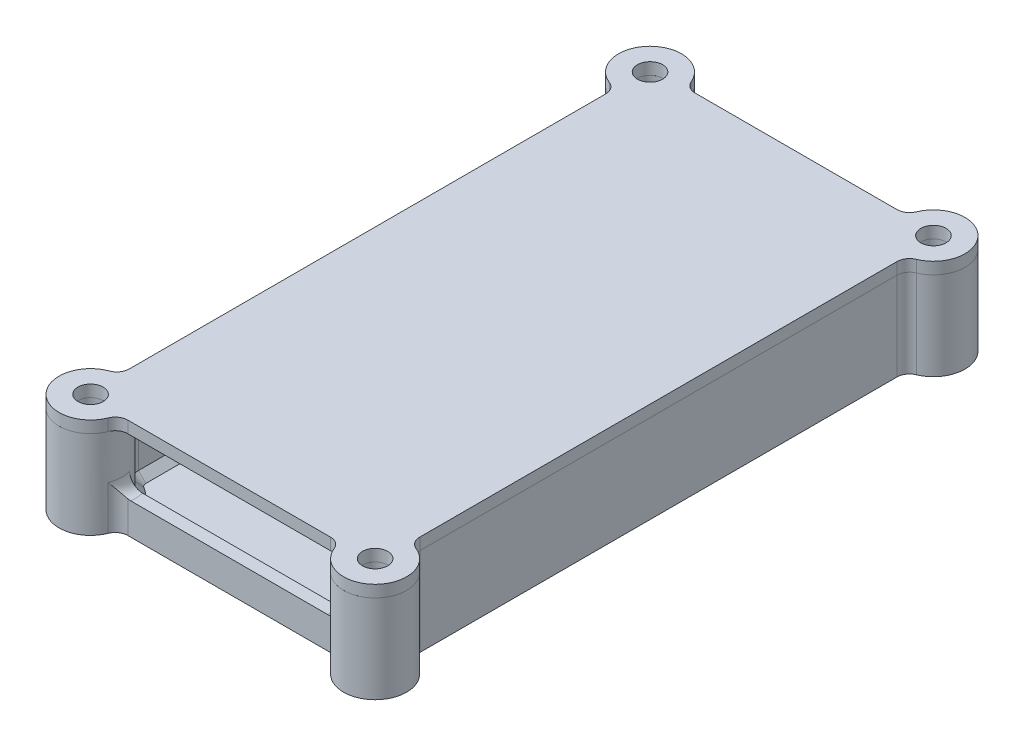
from build123d import *

# Parameters (mm, degrees)
SKETCH1_R             = 2.54
BOSS_EXTRUDE1_DEPTH   = 17.78
SKETCH1_W             = 2.54
SKETCH1_H             = 50.8
BOSS_EXTRUDE1_2_DEPTH = 17.78
SKETCH25_W            = 25.4
SKETCH25_H            = 50.8
SKETCH25_R            = 1.4605
BOSS_EXTRUDE10_DEPTH  = 2.54
SKETCH16_R            = 1.4605
BOSS_EXTRUDE8_DEPTH   = 7.62
SKETCH17_W            = 53.34
SKETCH17_H            = 2.54
BOSS_EXTRUDE9_DEPTH   = 10.16
BOSS_EXTRUDE11_DEPTH  = 6.35
CUT_EXTRUDE7_REACH    = 128.18
SKETCH20_W            = 25.4
SKETCH20_H            = 11.43
FILLET1_R             = 2.54
CHAMFER1_SIZE         = 1.5
CHAMFER2_SIZE         = 0.399999962
SKETCH28_R            = 2.54
BOSS_EXTRUDE12_DEPTH  = 2.38125


with BuildPart() as part:
    # Sketch1 → Boss-Extrude1 (new body)
    with BuildSketch(Plane(origin=(0, 0, 0), x_dir=(1, 0, 0), z_dir=(0, 1, 0))):
        with BuildLine():
            Line((-26.67, -38.956245374), (-26.67, 61.662538154))
            ThreePointArc((-26.67, 61.662538154), (-24.002733366, 63.313593433), (-22.451281767, 66.04))
            Line((-22.451281767, 66.04), (22.451281767, 66.04))
            ThreePointArc((22.451281767, 66.04), (24.002733366, 63.313593433), (26.67, 61.662538154))
            Line((26.67, 61.662538154), (26.67, -38.956245374))
            ThreePointArc((26.67, -38.956245374), (29.345391856, -51.292242337), (29.434947917, -38.669781311))
            Line((29.434947917, -38.669781311), (29.434947917, 61.428550705))
            ThreePointArc((29.434947917, 61.428550705), (33.065128061, 72.210180143), (22.283498623, 68.58))
            Line((22.283498623, 68.58), (-22.283498623, 68.58))
            ThreePointArc((-22.283498623, 68.58), (-33.14450183, 72.129377771), (-29.21, 61.401881857))
            Line((-29.21, 61.401881857), (-29.21, -38.647296362))
            ThreePointArc((-29.21, -38.647296362), (-29.457720789, -51.27959292), (-26.67, -38.956245374))
        make_face()
        with Locations(Location((-28.690999142, -44.976051224, 0), (0, 0, 270))):
            Circle(SKETCH1_R, mode=Mode.SUBTRACT)
        with Locations(Location((-28.575, 67.720052083, 0), (0, 0, 270))):
            Circle(SKETCH1_R, mode=Mode.SUBTRACT)
        with Locations(Location((28.690999142, -44.976051224, 0), (0, 0, 270))):
            Circle(SKETCH1_R, mode=Mode.SUBTRACT)
        with Locations(Location((28.575, 67.720052083, 0), (0, 0, 270))):
            Circle(SKETCH1_R, mode=Mode.SUBTRACT)
    extrude(amount=BOSS_EXTRUDE1_DEPTH)



with BuildPart() as body_2:
    # Sketch1 → Boss-Extrude1 2 (new body)
    with BuildSketch(Plane(origin=(0, 0, 0), x_dir=(1, 0, 0), z_dir=(0, 1, 0))):
        Rectangle(SKETCH1_W, SKETCH1_H)
    extrude(amount=BOSS_EXTRUDE1_2_DEPTH)


with BuildPart() as part_1:
    add(part.part)

    add(body_2.part)  # Boss-Extrude10 merges body 2
    # Sketch25 → Boss-Extrude10 (add)
    # profile 1 of 4: a face of its own
    with BuildSketch(Plane(origin=(0, 0, 0), x_dir=(1, 0, 0), z_dir=(0, 1, 0))):
        with Locations((-13.97, 0)):
            Rectangle(SKETCH25_W, SKETCH25_H)
        with Locations(Location((-4.6736, 16.637, 0), (0, 0, 270))):
            Circle(SKETCH25_R, mode=Mode.SUBTRACT)
        with Locations(Location((-23.368, -17.78, 0), (0, 0, 270))):
            Circle(SKETCH25_R, mode=Mode.SUBTRACT)
    # profile 2 of 4: a face of its own
    with BuildSketch(Plane(origin=(0, 0, 0), x_dir=(1, 0, 0), z_dir=(0, 1, 0))):
        with Locations((13.97, 0)):
            Rectangle(SKETCH25_W, SKETCH25_H)
        with Locations(Location((4.572, -17.78, 0), (0, 0, 270))):
            Circle(SKETCH25_R, mode=Mode.SUBTRACT)
        with Locations(Location((23.2664, 16.637, 0), (0, 0, 270))):
            Circle(SKETCH25_R, mode=Mode.SUBTRACT)
    # profile 3 of 4: a face of its own
    with BuildSketch(Plane(origin=(0, 0, 0), x_dir=(1, 0, 0), z_dir=(0, 1, 0))):
        with BuildLine():
            Line((-26.67, 27.94), (26.67, 27.94))
            Line((26.67, 27.94), (26.67, 61.662538154))
            ThreePointArc((26.67, 61.662538154), (24.002733366, 63.313593433), (22.451281767, 66.04))
            Line((22.451281767, 66.04), (-22.451281767, 66.04))
            ThreePointArc((-22.451281767, 66.04), (-24.002733366, 63.313593433), (-26.67, 61.662538154))
            Line((-26.67, 61.662538154), (-26.67, 27.94))
        make_face()
    # profile 4 of 4: a face of its own
    with BuildSketch(Plane(origin=(0, 0, 0), x_dir=(1, 0, 0), z_dir=(0, 1, 0))):
        with BuildLine():
            Line((26.894947917, -38.88534519), (26.894947917, -27.94))
            Line((26.894947917, -27.94), (-26.67, -27.94))
            Line((-26.67, -27.94), (-26.67, -38.956245374))
            ThreePointArc((-26.67, -38.956245374), (-24.118257513, -40.570085496), (-22.600293107, -43.18))
            Line((-22.600293107, -43.18), (22.600293107, -43.18))
            ThreePointArc((22.600293107, -43.18), (24.200871081, -40.485923164), (26.894947917, -38.88534519))
        make_face()
    extrude(amount=BOSS_EXTRUDE10_DEPTH)

    # Sketch16 → Boss-Extrude8 (add)
    with BuildSketch(Plane(origin=(0, 0, 0), x_dir=(1, 0, 0), z_dir=(0, 1, 0))):
        with Locations(Location((-4.6736, 16.637, 0), (0, 0, 90))):
            Circle(SKETCH16_R)
        with Locations(Location((-23.368, -17.78, 0), (0, 0, 90))):
            Circle(SKETCH16_R)
        with Locations(Location((4.572, -17.78, 0), (0, 0, 90))):
            Circle(SKETCH16_R)
        with Locations(Location((23.2664, 16.637, 0), (0, 0, 90))):
            Circle(SKETCH16_R)
    extrude(amount=BOSS_EXTRUDE8_DEPTH)

    # Sketch17 → Boss-Extrude9 (add)
    with BuildSketch(Plane(origin=(0, 0, 0), x_dir=(1, 0, 0), z_dir=(0, 1, 0))):
        with Locations((0, -26.67)):
            Rectangle(SKETCH17_W, SKETCH17_H)
        with Locations((0, 26.67)):
            Rectangle(SKETCH17_W, SKETCH17_H)
    extrude(amount=BOSS_EXTRUDE9_DEPTH)

    # Sketch27 → Boss-Extrude11 (add)
    with BuildSketch(Plane(origin=(0, 0, 0), x_dir=(1, 0, 0), z_dir=(0, 1, 0))):
        with BuildLine():
            Line((22.600293107, -43.18), (-22.600293107, -43.18))
            ThreePointArc((-22.600293107, -43.18), (-22.406156927, -44.068715377), (-22.340999142, -44.976051224))
            ThreePointArc((-22.340999142, -44.976051224), (-22.351941091, -45.348667683), (-22.384729228, -45.72))
            Line((-22.384729228, -45.72), (22.384729228, -45.72))
            ThreePointArc((22.384729228, -45.72), (22.363744353, -44.439071861), (22.600293107, -43.18))
        make_face()
    extrude(amount=BOSS_EXTRUDE11_DEPTH)

    # Sketch20 → Cut-Extrude7 (cut, up to next)
    with BuildSketch(Plane(origin=(0, 0, -68.58), x_dir=(-1, 0, 0), z_dir=(0, 0, -1)), mode=Mode.PRIVATE) as cut_extrude7_sk1:
        with Locations((0, 12.065)):
            Rectangle(SKETCH20_W, SKETCH20_H)
    cut_extrude7_tool1 = extrude(cut_extrude7_sk1.sketch, amount=-CUT_EXTRUDE7_REACH, mode=Mode.PRIVATE) & part_1.part
    add(cut_extrude7_tool1.solids().sort_by_distance((0, 12.065, -68.58))[0], mode=Mode.SUBTRACT)

    # Fillet1
    fillet1_edges = [part_1.edges().sort_by_distance(p)[0] for p in [
        (22.363744353, 6.35, 44.439071861),
        (22.384729228, 3.175, 45.72),
        (22.600293107, 4.445, 43.18),
        (-22.384729228, 3.175, 45.72),
        (-22.363744353, 6.35, 44.439071861),
        (-12.7, 6.35, -67.31),
        (-12.7, 17.78, -67.31),
        (12.7, 17.78, -67.31),
        (12.7, 6.35, -67.31),
        (26.67, 10.16, -61.662538154),
        (22.451281767, 10.16, -66.04),
        (-22.451281767, 10.16, -66.04),
        (-26.67, 10.16, -61.662538154),
        (-26.67, 10.16, 38.956245374),
        (-29.21, 8.89, 38.647296362),
        (-29.21, 8.89, -61.401881857),
        (-22.283498623, 8.89, -68.58),
        (22.283498623, 8.89, -68.58),
        (29.434947917, 8.89, -61.428550705),
        (29.434947917, 8.89, 38.669781311),
        (26.67, 10.16, 38.956245374),
    ]]
    fillet(fillet1_edges, radius=FILLET1_R)

    # Chamfer1
    chamfer1_edges = [part_1.edges().sort_by_distance(p)[0] for p in [
        (-26.67, 2.54, -43.980543121),
        (0, 2.54, -27.94),
        (26.67, 2.54, -43.980543121),
        (-23.672253404, 2.54, 41.085718176),
        (0, 2.54, 27.94),
        (-26.67, 2.54, 32.642616498),
        (-0.835070922, 2.54, 43.18),
        (0, 10.16, 25.4),
        (-26.67, 10.16, 26.67),
        (26.67, 10.16, 26.67),
        (-26.67, 10.16, -26.67),
        (0, 10.16, -25.4),
        (26.67, 10.16, -26.67),
        (24.1357347, 2.54, 40.552018463),
        (26.67, 2.54, 32.642616498),
        (22.215621155, 2.54, 42.830700153),
        (26.339251257, 2.54, 38.598552143),
        (-26.339251257, 2.54, 38.598552143),
        (0, 2.54, -66.04),
        (24.020284559, 2.54, -63.295454107),
        (-24.020284559, 2.54, -63.295454107),
        (-26.329704526, 2.54, -61.291086243),
        (-22.052209415, 2.54, -65.681072223),
        (26.329704526, 2.54, -61.291086243),
        (22.052209415, 2.54, -65.681072223),
        (0, 17.78, 25.4),
        (0, 17.78, -25.4),
    ]]
    chamfer(chamfer1_edges, length=CHAMFER1_SIZE)

    # Chamfer2
    chamfer2_edges = [part_1.edges().sort_by_distance(p)[0] for p in [
        (-13.97, 2.54, -25.4),
        (-26.67, 2.54, 0),
        (-23.368, 2.54, 19.2405),
        (-4.6736, 2.54, -15.1765),
        (-13.97, 2.54, 25.4),
        (-1.27, 2.54, 0),
        (1.27, 2.54, 0),
        (23.2664, 2.54, -15.1765),
        (4.572, 2.54, 19.2405),
        (13.97, 2.54, 25.4),
        (26.67, 2.54, 0),
        (13.97, 2.54, -25.4),
    ]]
    chamfer(chamfer2_edges, length=CHAMFER2_SIZE)


with BuildPart() as body_2_2:
    # Sketch28 → Boss-Extrude12 (new body)
    with BuildSketch(Plane(origin=(0, 17.78, 0), x_dir=(1, 0, 0), z_dir=(0, 1, 0))):
        with BuildLine():
            Line((-29.21, 59.416349595), (-29.21, -36.628919157))
            ThreePointArc((-29.21, -36.628919157), (-29.667746338, -38.083504902), (-30.875999755, -39.013814033))
            ThreePointArc((-30.875999755, -39.013814033), (-33.241525309, -49.404957591), (-22.790126652, -47.321728921))
            ThreePointArc((-22.790126652, -47.321728921), (-21.856029993, -46.158237818), (-20.429777656, -45.72))
            Line((-20.429777656, -45.72), (20.429777656, -45.72))
            ThreePointArc((20.429777656, -45.72), (21.856029993, -46.158237818), (22.790126652, -47.321728921))
            ThreePointArc((22.790126652, -47.321728921), (33.181127202, -49.466179285), (31.036676839, -39.075178734))
            ThreePointArc((31.036676839, -39.075178734), (29.873185735, -38.141082076), (29.434947917, -36.714829738))
            Line((29.434947917, -36.714829738), (29.434947917, 59.505890278))
            ThreePointArc((29.434947917, 59.505890278), (29.863196183, 60.917309639), (31.003534227, 61.85279365))
            ThreePointArc((31.003534227, 61.85279365), (33.065128061, 72.210180143), (22.707741568, 70.148586309))
            ThreePointArc((22.707741568, 70.148586309), (21.772257556, 69.008248266), (20.360838195, 68.58))
            Line((20.360838195, 68.58), (-20.360838195, 68.58))
            ThreePointArc((-20.360838195, 68.58), (-21.772257556, 69.008248266), (-22.707741568, 70.148586309))
            ThreePointArc((-22.707741568, 70.148586309), (-33.125854715, 72.148620854), (-30.842857143, 61.78883602))
            ThreePointArc((-30.842857143, 61.78883602), (-29.657663644, 60.856394237), (-29.21, 59.416349595))
        make_face()
        with Locations(Location((28.690999142, -44.976051224, 0), (0, 0, 90))):
            Circle(SKETCH28_R, mode=Mode.SUBTRACT)
        with Locations(Location((-28.690999142, -44.976051224, 0), (0, 0, 90))):
            Circle(SKETCH28_R, mode=Mode.SUBTRACT)
        with Locations(Location((-28.575, 67.720052083, 0), (0, 0, 90))):
            Circle(SKETCH28_R, mode=Mode.SUBTRACT)
        with Locations(Location((28.575, 67.720052083, 0), (0, 0, 90))):
            Circle(SKETCH28_R, mode=Mode.SUBTRACT)
    extrude(amount=BOSS_EXTRUDE12_DEPTH)


solid = Compound([part_1.part, body_2_2.part])
